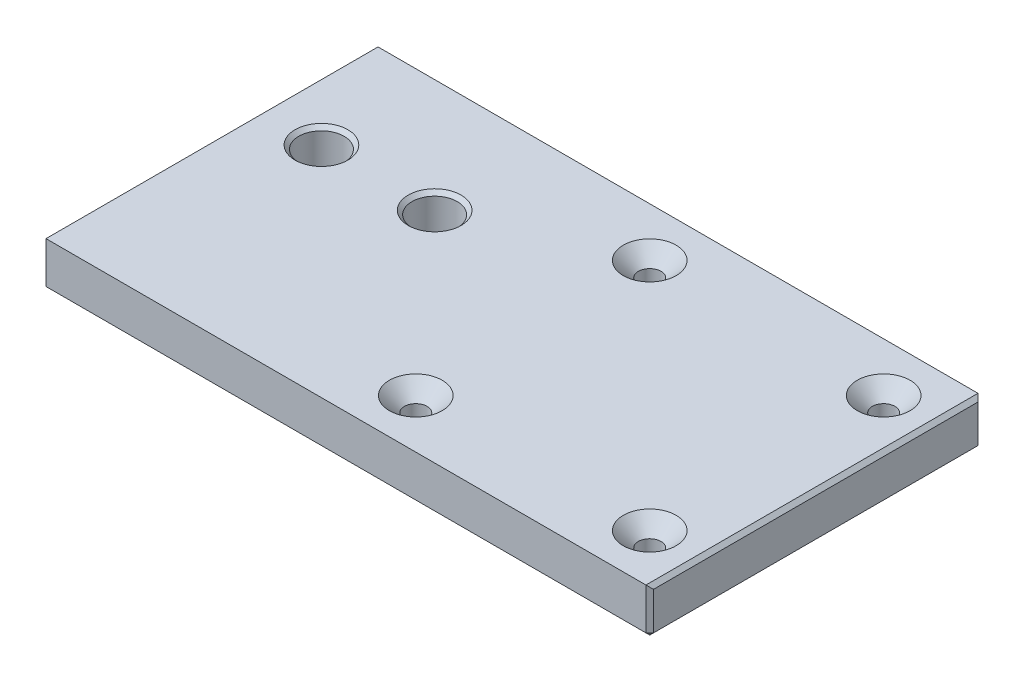
from build123d import *

# Parameters (mm, degrees)
CROQUIS1_W              = 80.5
CROQUIS1_H              = 44
CROQUIS1_R              = 1.5
CROQUIS1_R_2            = 3
SALIENTE_EXTRUIR1_DEPTH = 6
CHAFL_N1_SIZE           = 0.5
CHAFL_N2_SIZE           = 2


with BuildPart() as part:
    # Croquis1 → Saliente-Extruir1 (new body)
    with BuildSketch(Plane(origin=(0, 0, 0), x_dir=(1, 0, 0), z_dir=(0, 1, 0))):
        with Locations((7.521686308, -1.221461187)):
            Rectangle(CROQUIS1_W, CROQUIS1_H)
        with Locations(Location((10.271686308, 14.278538813, 0), (0, 0, 270))):
            Circle(CROQUIS1_R, mode=Mode.SUBTRACT)
        with Locations(Location((41.271686308, 14.278538813, 0), (0, 0, 270))):
            Circle(CROQUIS1_R, mode=Mode.SUBTRACT)
        with Locations(Location((10.271686308, -16.721461187, 0), (0, 0, 270))):
            Circle(CROQUIS1_R, mode=Mode.SUBTRACT)
        with Locations(Location((41.271686308, -16.721461187, 0), (0, 0, 270))):
            Circle(CROQUIS1_R, mode=Mode.SUBTRACT)
        with Locations(Location((-24.728313692, 5.778538813, 0), (0, 0, 270))):
            Circle(CROQUIS1_R_2, mode=Mode.SUBTRACT)
        with Locations(Location((-9.728313692, 5.778538813, 0), (0, 0, 270))):
            Circle(CROQUIS1_R_2, mode=Mode.SUBTRACT)
    extrude(amount=SALIENTE_EXTRUIR1_DEPTH)

    # Chaflán1
    chafl_n1_edges = [part.edges().sort_by_distance(p)[0] for p in [
        (47.771686308, 6, 1.221461187),
        (10.271686308, 0, -15.778538813),
        (41.271686308, 0, -15.778538813),
        (10.271686308, 0, 15.221461187),
        (41.271686308, 0, 15.221461187),
        (-24.728313692, 0, -8.778538813),
        (-24.728313692, 6, -8.778538813),
        (-9.728313692, 0, -8.778538813),
        (-9.728313692, 6, -8.778538813),
        (-32.728313692, 6, 1.221461187),
        (7.521686308, 0, -20.778538813),
        (47.771686308, 0, 1.221461187),
        (7.521686308, 0, 23.221461187),
        (-32.728313692, 0, 1.221461187),
        (-32.728313692, 3, -20.778538813),
        (47.771686308, 3, -20.778538813),
        (47.771686308, 3, 23.221461187),
        (-32.728313692, 3, 23.221461187),
    ]]
    chamfer(chafl_n1_edges, length=CHAFL_N1_SIZE)

    # Chaflán2
    chafl_n2_edges = [part.edges().sort_by_distance(p)[0] for p in [
        (10.271686308, 6, -15.778538813),
        (41.271686308, 6, -15.778538813),
        (10.271686308, 6, 15.221461187),
        (41.271686308, 6, 15.221461187),
    ]]
    chamfer(chafl_n2_edges, length=CHAFL_N2_SIZE)


solid = part.part
